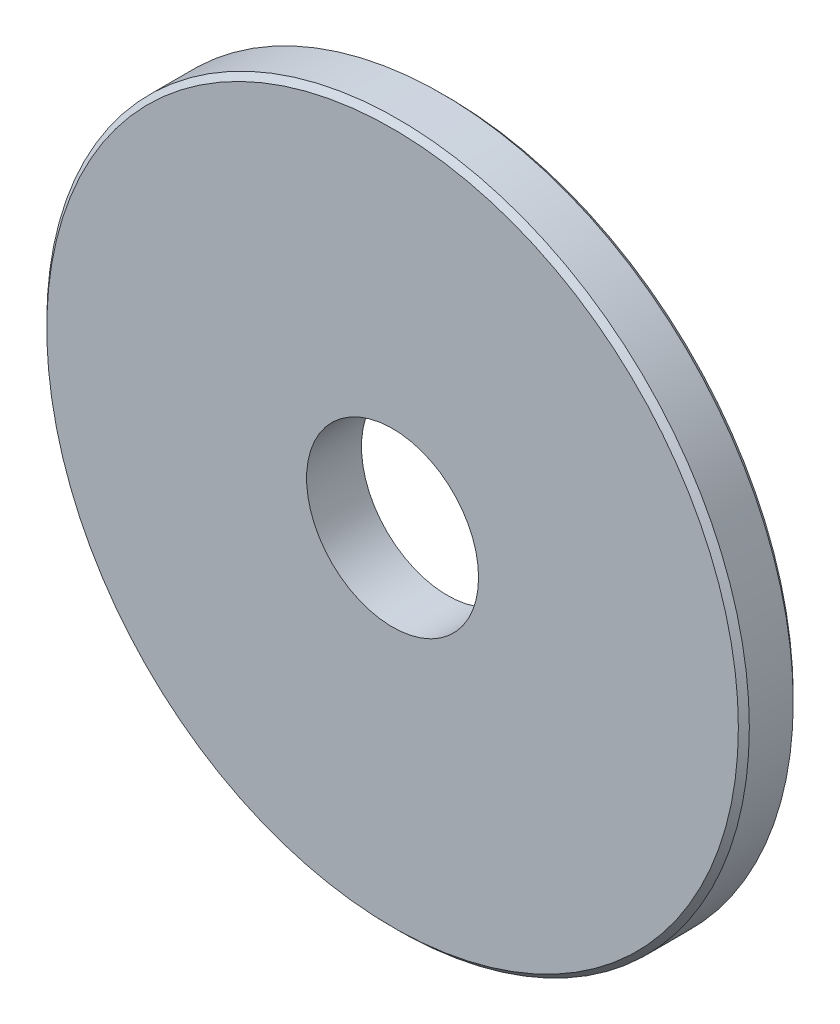
from build123d import *

# Parameters (mm, degrees)
SKETCH1_R           = 64.016017099
SKETCH1_R_2         = 15.67256847
BOSS_EXTRUDE1_DEPTH = 10
CHAMFER1_SIZE       = 1


with BuildPart() as part:
    # Sketch1 → Boss-Extrude1 (new body)
    with BuildSketch(Plane.XY):
        Circle(SKETCH1_R)
        Circle(SKETCH1_R_2, mode=Mode.SUBTRACT)
    extrude(amount=BOSS_EXTRUDE1_DEPTH)

    # Chamfer1
    chamfer1_edges = [part.edges().sort_by_distance(p)[0] for p in [
        (-64.016017099, 0, 0),
        (-64.016017099, 0, 10),
    ]]
    chamfer(chamfer1_edges, length=CHAMFER1_SIZE)


solid = part.part
